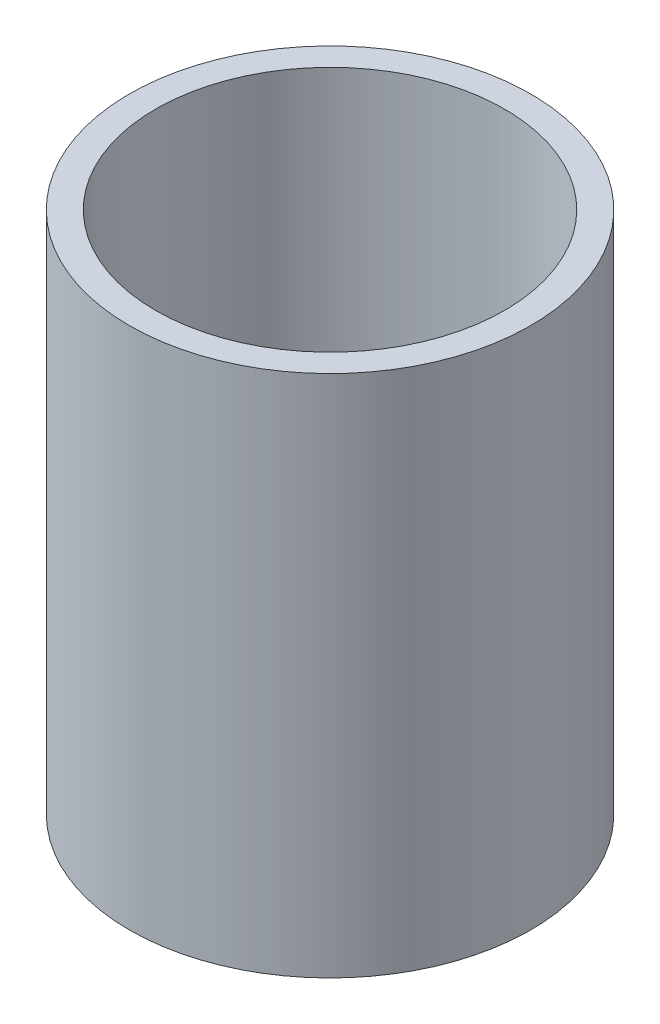
from build123d import *

# Parameters (mm, degrees)
SKETCH1_R           = 23
BOSS_EXTRUDE1_DEPTH = 60
SKETCH2_R           = 20
CUT_EXTRUDE1_DEPTH  = 22
CUT_EXTRUDE2_START  = -32
SKETCH5_R           = 20
CUT_EXTRUDE2_DEPTH  = 32
SKETCH4_R           = 2
CUT_EXTRUDE3_DEPTH  = 40


with BuildPart() as part:
    # Sketch1 → Boss-Extrude1 (new body)
    with BuildSketch(Plane(origin=(0, 0, 0), x_dir=(1, 0, 0), z_dir=(0, 1, 0))):
        with Locations(Location((0, 0, 0), (0, 0, 270))):
            Circle(SKETCH1_R)
    extrude(amount=BOSS_EXTRUDE1_DEPTH)

    # Sketch2 → Cut-Extrude1 (cut)
    with BuildSketch(Plane.XZ):
        with Locations(Location((0, 0, 0), (0, 0, 270))):
            Circle(SKETCH2_R)
    extrude(amount=-CUT_EXTRUDE1_DEPTH, mode=Mode.SUBTRACT)

    # Sketch5 → Cut-Extrude2 (cut)
    with BuildSketch(Plane(origin=(0, 60, 0), x_dir=(1, 0, 0), z_dir=(0, 1, 0)).offset(CUT_EXTRUDE2_START)):
        with Locations(Location((0, 0, 0), (0, 0, 90))):
            Circle(SKETCH5_R)
    extrude(amount=CUT_EXTRUDE2_DEPTH, mode=Mode.SUBTRACT)

    # Sketch4 → Cut-Extrude3 (cut)
    with BuildSketch(Plane.XZ.offset(-22)):
        with Locations(Location((0, 0, 0), (0, 0, 270))):
            Circle(SKETCH4_R)
    extrude(amount=-CUT_EXTRUDE3_DEPTH, mode=Mode.SUBTRACT)


solid = part.part
